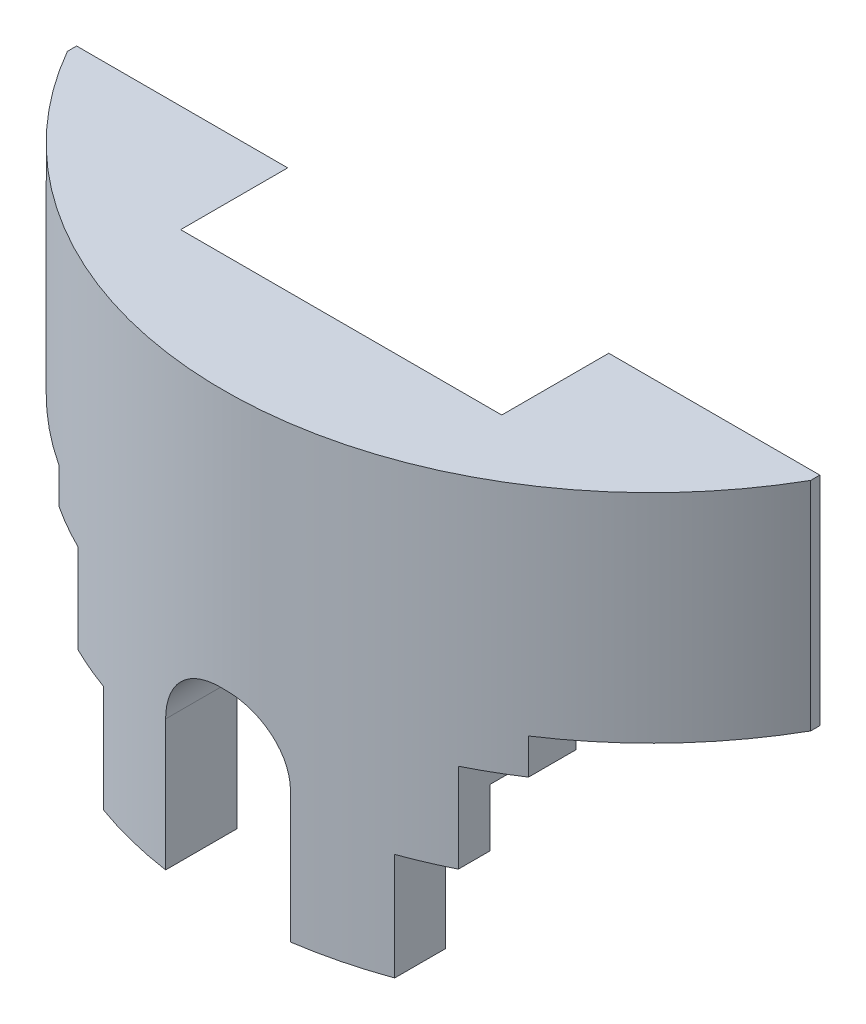
from build123d import *

# Parameters (mm, degrees)
BOSS_EXTRUDE1_DEPTH = 36.5
BOSS_EXTRUDE2_DEPTH = 6
BOSS_EXTRUDE3_DEPTH = 15
BOSS_EXTRUDE4_DEPTH = 18
CUT_EXTRUDE2_DEPTH  = 25
SKETCH5_W           = 21
SKETCH5_H           = 37.8
CUT_EXTRUDE1_DEPTH  = 32
FILLET1_R           = 10
CUT_EXTRUDE3_DEPTH  = 18
SKETCH9_W           = 86.823098523
SKETCH9_H           = 11.225168108
CUT_EXTRUDE4_DEPTH  = 18


with BuildPart() as part:
    # Sketch1 → Boss-Extrude1 (new body)
    with BuildSketch(Plane(origin=(0, 0, 0), x_dir=(1, 0, 0), z_dir=(0, 1, 0))):
        with BuildLine():
            Line((-62.5, -34.2), (-62.5, -35.745629103))
            ThreePointArc((-62.5, -35.745629103), (0, -72), (62.5, -35.745629103))
            Line((62.5, -35.745629103), (62.5, -34.2))
            Line((62.5, -34.2), (-62.5, -34.2))
        make_face()
    extrude(amount=-BOSS_EXTRUDE1_DEPTH)

    # Sketch2 → Boss-Extrude2 (add)
    with BuildSketch(Plane.XZ.offset(36.5)):
        with BuildLine():
            ThreePointArc((39.5, 60.197591314), (0, 72), (-39.5, 60.197591314))
            Line((-39.5, 60.197591314), (-39.5, 34.2))
            Line((-39.5, 34.2), (39.5, 34.2))
            Line((39.5, 34.2), (39.5, 60.197591314))
        make_face()
    extrude(amount=BOSS_EXTRUDE2_DEPTH)

    # Sketch3 → Boss-Extrude3 (add)
    with BuildSketch(Plane.XZ.offset(42.5)):
        with BuildLine():
            Line((-32, 64.498061986), (-32, 34.2))
            Line((-32, 34.2), (32, 34.2))
            Line((32, 34.2), (32, 64.498061986))
            ThreePointArc((32, 64.498061986), (0, 72), (-32, 64.498061986))
        make_face()
    extrude(amount=BOSS_EXTRUDE3_DEPTH)

    # Sketch4 → Boss-Extrude4 (add)
    with BuildSketch(Plane.XZ.offset(57.5)):
        with BuildLine():
            Line((-24.5, 34.2), (-24.5, 67.703397256))
            ThreePointArc((-24.5, 67.703397256), (0, 72), (24.5, 67.703397256))
            Line((24.5, 67.703397256), (24.5, 34.2))
            Line((24.5, 34.2), (-24.5, 34.2))
        make_face()
    extrude(amount=BOSS_EXTRUDE4_DEPTH)

    # Sketch7 → Cut-Extrude2 (cut)
    with BuildSketch(Plane(origin=(0, 0, 34.2), x_dir=(-1, 0, 0), z_dir=(0, 0, -1))):
        with BuildLine():
            Line((-32.5, -53.5), (-32.5, -86))
            Line((-32.5, -86), (32.5, -86))
            Line((32.5, -86), (32.5, -53.5))
            ThreePointArc((32.5, -53.5), (0, -21), (-32.5, -53.5))
        make_face()
    extrude(amount=-CUT_EXTRUDE2_DEPTH, mode=Mode.SUBTRACT)

    # Sketch5 → Cut-Extrude1 (cut)
    with BuildSketch(Plane.XZ.offset(75.5)):
        with Locations((0, 53.1)):
            Rectangle(SKETCH5_W, SKETCH5_H)
    extrude(amount=-CUT_EXTRUDE1_DEPTH, mode=Mode.SUBTRACT)

    # Fillet1
    fillet1_edges = [part.edges().sort_by_distance(p)[0] for p in [
        (-10.5, -43.5, 65.215130212),
        (10.5, -43.5, 65.215130212),
    ]]
    fillet(fillet1_edges, radius=FILLET1_R)

    # Sketch8 → Cut-Extrude3 (cut)
    with BuildSketch(Plane(origin=(0, 0, 34.2), x_dir=(-1, 0, 0), z_dir=(0, 0, -1))):
        with BuildLine():
            Line((-27, 0), (27, 0))
            ThreePointArc((27, 0), (49, -22), (27, -44))
            Line((27, -44), (-27, -44))
            ThreePointArc((-27, -44), (-49, -22), (-27, 0))
        make_face()
    extrude(amount=-CUT_EXTRUDE3_DEPTH, mode=Mode.SUBTRACT)

    # Sketch9 → Cut-Extrude4 (cut)
    with BuildSketch(Plane(origin=(0, 0, 34.2), x_dir=(-1, 0, 0), z_dir=(0, 0, -1))):
        with Locations((0.144250153, -44.182683468)):
            Rectangle(SKETCH9_W, SKETCH9_H)
    extrude(amount=-CUT_EXTRUDE4_DEPTH, mode=Mode.SUBTRACT)


solid = part.part
